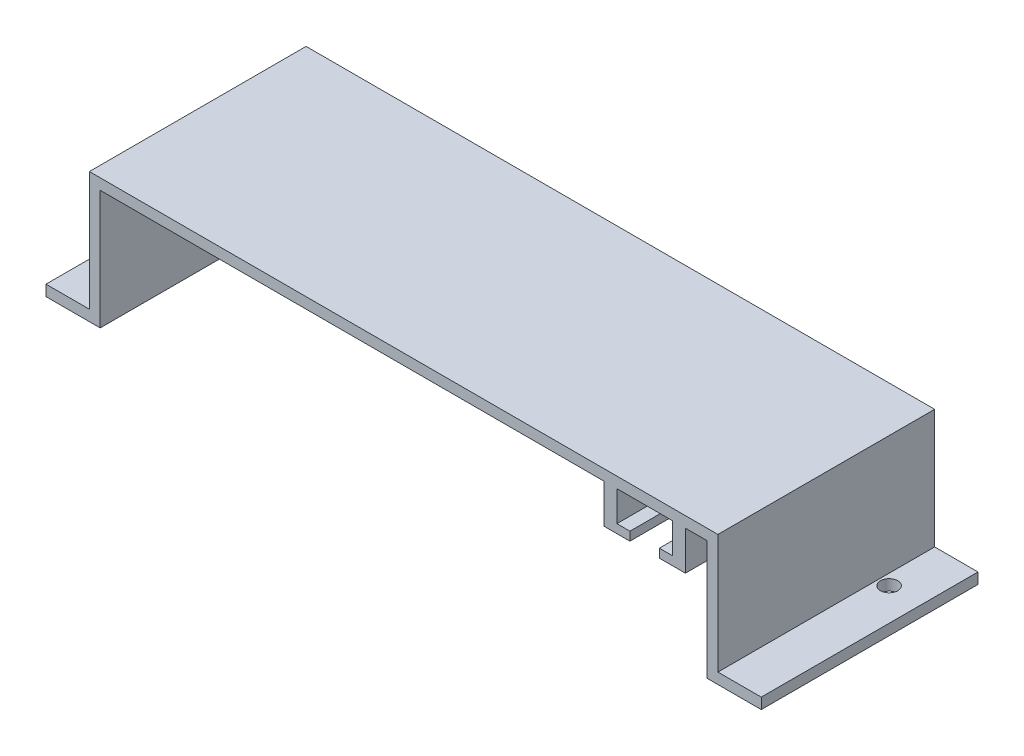
from build123d import *

# Parameters (mm, degrees)
SKETCH1_W           = 177.8
SKETCH1_H           = 63.5
BOSS_EXTRUDE1_DEPTH = 3.175
SKETCH3_W           = 3.175
SKETCH3_H           = 63.5
BOSS_EXTRUDE2_DEPTH = 38.1
SKETCH4_W           = 63.5
SKETCH4_H           = 3.175
BOSS_EXTRUDE3_DEPTH = 12.7
SKETCH5_R           = 2.54
CUT_EXTRUDE1_DEPTH  = 12.7
BOSS_EXTRUDE4_DEPTH = 63.5


with BuildPart() as part:
    # Sketch1 → Boss-Extrude1 (new body)
    with BuildSketch(Plane(origin=(0, 0, 0), x_dir=(1, 0, 0), z_dir=(0, 1, 0))):
        Rectangle(SKETCH1_W, SKETCH1_H)
    extrude(amount=BOSS_EXTRUDE1_DEPTH)

    # Sketch3 → Boss-Extrude2 (add)
    with BuildSketch(Plane(origin=(0, 3.175, 0), x_dir=(1, 0, 0), z_dir=(0, 1, 0))):
        with Locations((-90.4875, 0)):
            Rectangle(SKETCH3_W, SKETCH3_H)
        with Locations((90.4875, 0)):
            Rectangle(SKETCH3_W, SKETCH3_H)
    extrude(amount=-BOSS_EXTRUDE2_DEPTH)

    # Sketch4 → Boss-Extrude3 (add)
    with BuildSketch(Plane(origin=(92.075, 0, 0), x_dir=(0, 0, -1), z_dir=(1, 0, 0))):
        with Locations((0, -33.3375)):
            Rectangle(SKETCH4_W, SKETCH4_H)
    boss_extrude3 = extrude(amount=BOSS_EXTRUDE3_DEPTH)

    # Sketch5 → Cut-Extrude1 (cut)
    with BuildSketch(Plane.XZ.offset(34.925)):
        with Locations(Location((95.25, -15.24, 0), (0, 0, 270))):
            Circle(SKETCH5_R)
    cut_extrude1 = extrude(amount=-CUT_EXTRUDE1_DEPTH, mode=Mode.SUBTRACT)

    # Mirror1: Boss-Extrude3, Cut-Extrude1 across plane
    add(boss_extrude3.mirror(Plane(origin=(0, 0, 0), x_dir=(0, 0, 1), z_dir=(1, 0, 0))))
    add(cut_extrude1.mirror(Plane(origin=(0, 0, 0), x_dir=(0, 0, 1), z_dir=(1, 0, 0))), mode=Mode.SUBTRACT)

    # Sketch6 → Boss-Extrude4 (add)
    with BuildSketch(Plane.XY.offset(31.75)):
        Polygon((58.674, 0), (58.674, -11.43), (66.294, -11.43), (66.294, -8.89), (62.484, -8.89), (62.484, 0), align=None)
        Polygon((82.55, 0), (82.55, -11.43), (74.93, -11.43), (74.93, -8.89), (78.74, -8.89), (78.74, 0), align=None)
    extrude(amount=-BOSS_EXTRUDE4_DEPTH)


solid = part.part
